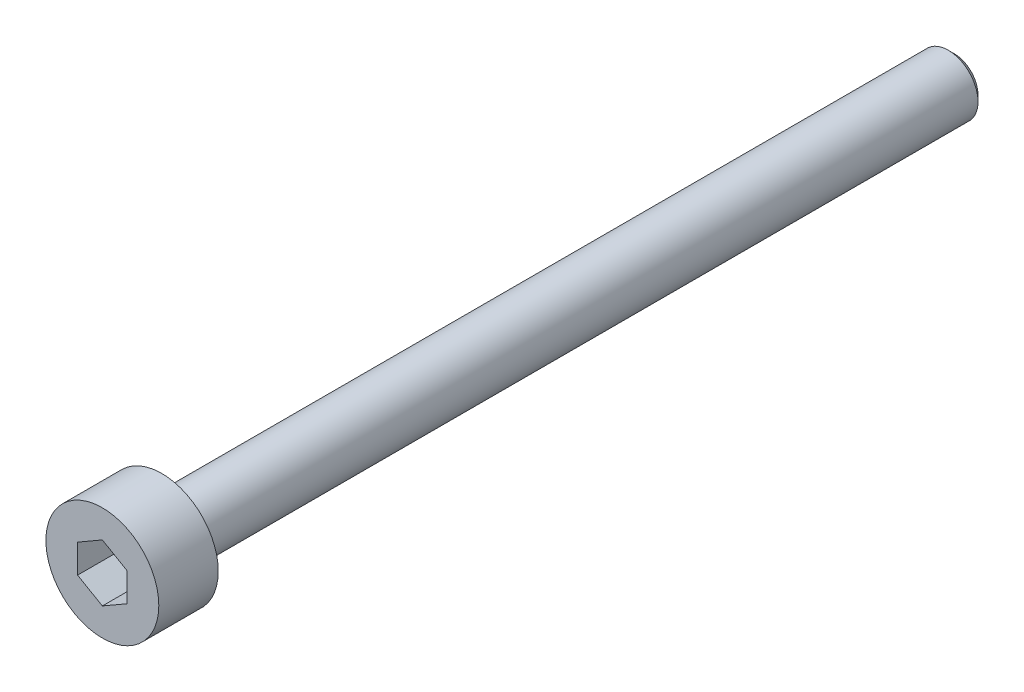
from build123d import *

# Parameters (mm, degrees)
SKETCH1_R           = 2.85
BOSS_EXTRUDE1_DEPTH = 3
SKETCH2_R           = 1.5
BOSS_EXTRUDE2_DEPTH = 40
CHAMFER1_SIZE       = 0.3
CUT_EXTRUDE1_DEPTH  = 2


with BuildPart() as part:
    # Sketch1 → Boss-Extrude1 (new body)
    with BuildSketch(Plane.XY):
        Circle(SKETCH1_R)
    extrude(amount=BOSS_EXTRUDE1_DEPTH)

    # Sketch2 → Boss-Extrude2 (add)
    with BuildSketch(Plane(origin=(0, 0, 0), x_dir=(-1, 0, 0), z_dir=(0, 0, -1))):
        with Locations(Location((0, 0, 0), (0, 0, 180))):
            Circle(SKETCH2_R)
    extrude(amount=BOSS_EXTRUDE2_DEPTH)

    # Chamfer1
    chamfer1_edges = [part.edges().sort_by_distance(p)[0] for p in [
        (-1.5, 0, -40),
    ]]
    chamfer(chamfer1_edges, length=CHAMFER1_SIZE)

    # Sketch3 → Cut-Extrude1 (cut)
    with BuildSketch(Plane.XY.offset(3)):
        Polygon((0, 1.443375673), (-1.25, 0.721687836), (-1.25, -0.721687836), (0, -1.443375673), (1.25, -0.721687836), (1.25, 0.721687836), align=None)
    extrude(amount=-CUT_EXTRUDE1_DEPTH, mode=Mode.SUBTRACT)


solid = part.part
